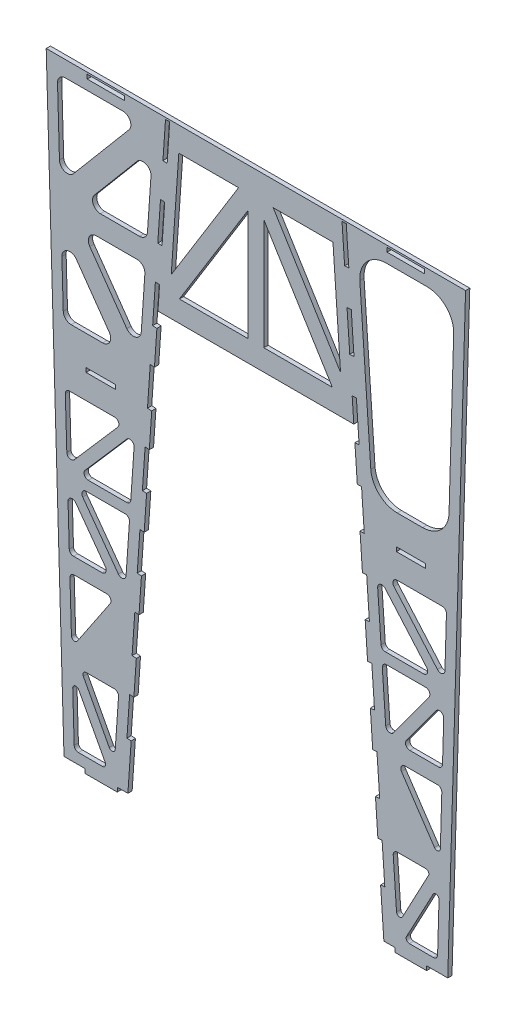
from build123d import *

# Parameters (mm, degrees)
BOSS_EXTRUDE1_DEPTH     = 10.16
CUT_EXTRUDE5_DEPTH      = 12.7
SKETCH4_W               = 90
SKETCH4_H               = 10.16
SKETCH4_W_2             = 70
CUT_EXTRUDE6_DEPTH      = 1549.932552155
CUT_EXTRUDE7_DEPTH      = 1549.932552155
FILLET3_R               = 10.16
FILLET4_R               = 7.62
FILLET5_R               = 19.05
FILLET3_OF_MIRROR2_R    = 10.16
FILLET4_OF_MIRROR2_R    = 7.62
FILLET5_OF_MIRROR2_R    = 19.05
CUT_EXTRUDE8_DEPTH      = 1549.932552155
CUT_EXTRUDE8_DEPTH_BACK = 1549.932552155
FILLET6_R               = 63.5
BOSS_EXTRUDE2_START     = -10.16
BOSS_EXTRUDE2_DEPTH     = 10.16


with BuildPart() as part:
    # Sketch1 → Boss-Extrude1 (new body)
    with BuildSketch(Plane.XY):
        Polygon((-502.379730266, 1465.163278322), (-459.721789204, 17.476365817), (-408.921789204, 17.476365817), (-408.921789204, 7.316365817), (-332.100796745, 7.316365817), (-332.100796745, 17.476365817), (-306.627827519, 17.476365817), (-234.627172097, 1054.1), (234.627172097, 1054.1), (306.627827519, 17.476365817), (332.721789205, 17.476365817), (332.721789205, 7.316365817), (408.921789205, 7.316365817), (408.921789205, 17.476365817), (459.721789204, 17.476365817), (502.379730266, 1465.163278322), align=None)
        Polygon((183.241683183, 1104.9), (19.05, 1104.9), (19.05, 1370.513387633), align=None, mode=Mode.SUBTRACT)
        Polygon((-184.672471746, 1406.743278322), (-41.445884435, 1406.743278322), (-202.802614973, 1145.716002246), align=None, mode=Mode.SUBTRACT)
        Polygon((-19.05, 1370.513387633), (-19.05, 1104.9), (-183.241683183, 1104.9), align=None, mode=Mode.SUBTRACT)
        Polygon((184.672471746, 1406.743278322), (202.802614973, 1145.716002246), (41.445884435, 1406.743278322), align=None, mode=Mode.SUBTRACT)
    extrude(amount=BOSS_EXTRUDE1_DEPTH)

    # Sketch2 → Cut-Extrude5 (cut)
    with BuildSketch(Plane.XY):
        Polygon((-222.69422447, 1372.274878096), (-212.576544386, 1371.572135487), (-206.36877838, 1460.947946306), (-216.535268781, 1460.947946306), align=None)
        Polygon((-224.894455765, 1194.225999066), (-235.012135849, 1194.928741675), (-228.490407278, 1288.824803216), (-218.372727194, 1288.122060607), align=None)
        Polygon((224.894455765, 1194.225999066), (235.012135849, 1194.928741675), (228.490407278, 1288.824803216), (218.372727194, 1288.122060607), align=None)
        Polygon((212.576544386, 1371.572135487), (222.694224471, 1372.274878096), (216.535268781, 1460.947946306), (206.36877838, 1460.947946306), align=None)
        Polygon((-240.810161517, 1111.452134365), (-247.330047228, 1017.582605255), (-237.212367144, 1016.879862645), (-230.692481433, 1110.749391756), align=None)
        Polygon((237.212367144, 1016.879862645), (247.330047228, 1017.582605255), (240.810161517, 1111.452134365), (230.692481433, 1110.749391756), align=None)
        Polygon((-298.801924037, 130.149180543), (-292.291252627, 223.886047498), (-302.408932711, 224.588790108), (-308.919604121, 130.851923152), align=None)
        Polygon((-243.012235672, 933.376722904), (-253.129915756, 934.079465513), (-259.647958606, 840.236468834), (-249.530278522, 839.533726225), align=None)
        Polygon((243.012235672, 933.376722904), (253.129915756, 934.079465513), (259.647958606, 840.236468834), (249.530278522, 839.533726225), align=None)
        Polygon((-274.16610128, 484.841453384), (-284.283781364, 485.544195993), (-277.769424233, 579.334127811), (-267.651744149, 578.631385201), align=None)
        Polygon((-261.848189901, 662.187589804), (-271.965869985, 662.890332413), (-265.449669994, 756.706796662), (-255.33198991, 756.004054053), align=None)
        Polygon((261.848189901, 662.187589804), (271.965869985, 662.890332413), (265.449669994, 756.706796662), (255.33198991, 756.004054053), align=None)
        Polygon((274.16610128, 484.841453384), (284.283781364, 485.544195993), (277.769424233, 579.334127811), (267.651744149, 578.631385201), align=None)
        Polygon((-286.484012658, 307.495316963), (-296.601692742, 308.198059572), (-290.089178472, 401.961458959), (-279.971498388, 401.25871635), align=None)
        Polygon((286.484012658, 307.495316963), (296.601692742, 308.198059572), (290.089178472, 401.961458959), (279.971498388, 401.25871635), align=None)
        Polygon((298.801924037, 130.149180543), (308.919604121, 130.851923152), (302.408932711, 224.588790108), (292.291252627, 223.886047498), align=None)
    extrude(amount=CUT_EXTRUDE5_DEPTH, mode=Mode.SUBTRACT)

    # Sketch4 → Cut-Extrude6 (cut, symmetric)
    with BuildSketch(Plane.XY.offset(10.16)):
        with Locations((359.197976087, 1455.867946306)):
            Rectangle(SKETCH4_W, SKETCH4_H)
        with Locations((371.773101272, 845.707946306)):
            Rectangle(SKETCH4_W_2, SKETCH4_H)
    cut_extrude6 = extrude(amount=CUT_EXTRUDE6_DEPTH, both=True, mode=Mode.SUBTRACT)

    # Mirror1: Cut-Extrude6 across plane
    add(cut_extrude6.mirror(Plane(origin=(0, 0, 0), x_dir=(0, 0, 1), z_dir=(1, 0, 0))), mode=Mode.SUBTRACT)

    # Sketch5 → Cut-Extrude7 (cut, symmetric)
    with BuildSketch(Plane.XY.offset(10.16)):
        Polygon((277.57407568, 1427.063278322), (469.151151359, 1199.858135079), (475.846040652, 1427.063278322), align=None)
        Polygon((247.332350967, 1384.123107242), (261.011042505, 1187.185612314), (413.388052133, 1187.185612314), align=None)
        Polygon((264.539459124, 1136.385612314), (278.411796263, 936.660125596), (419.073629592, 1136.385612314), align=None)
        Polygon((330.156313317, 921.907946306), (460.960994587, 921.907946306), (466.672719778, 1115.747348794), align=None)
        Polygon((316.123814072, 782.207946306), (452.23061276, 625.624084567), (456.844555932, 782.207946306), align=None)
        Polygon((289.718857385, 773.86792531), (300.433845179, 619.600037294), (423.812550982, 619.600037294), align=None)
        Polygon((302.198053489, 594.200037294), (313.00865126, 438.555614882), (426.677669108, 594.200037294), align=None)
        Polygon((348.650598884, 444.292128282), (446.887435422, 444.292128282), (451.017692353, 584.461080548), align=None)
        Polygon((338.197722634, 406.192128282), (441.242235204, 252.710390617), (445.764770334, 406.192128282), align=None)
        Polygon((316.139543948, 393.478923068), (326.550783398, 243.58421927), (416.77579504, 243.58421927), align=None)
        Polygon((328.314991708, 218.18421927), (338.831080002, 66.779965479), (419.448635625, 218.18421927), align=None)
        Polygon((354.87950725, 42.876310257), (435.059206432, 42.876310257), (439.756224914, 202.279507274), align=None)
    cut_extrude7 = extrude(amount=CUT_EXTRUDE7_DEPTH, both=True, mode=Mode.SUBTRACT)

    # Fillet3
    fillet3_edges = [part.edges().sort_by_distance(p)[0] for p in [
        (423.812550982, 619.600037294, 5.08),
        (300.433845179, 619.600037294, 5.08),
        (289.718857385, 773.86792531, 5.08),
        (426.677669108, 594.200037294, 5.08),
        (313.00865126, 438.555614882, 5.08),
        (302.198053489, 594.200037294, 5.08),
        (348.650598884, 444.292128282, 5.08),
        (451.017692353, 584.461080548, 5.08),
        (446.887435422, 444.292128282, 5.08),
        (338.197722634, 406.192128282, 5.08),
        (445.764770334, 406.192128282, 5.08),
        (316.123814072, 782.207946306, 5.08),
        (456.844555932, 782.207946306, 5.08),
        (452.23061276, 625.624084567, 5.08),
        (435.059206432, 42.876310257, 5.08),
        (328.314991708, 218.18421927, 5.08),
        (416.77579504, 243.58421927, 5.08),
        (326.550783398, 243.58421927, 5.08),
    ]]
    fillet(fillet3_edges, radius=FILLET3_R)

    # Fillet4
    fillet4_edges = [part.edges().sort_by_distance(p)[0] for p in [
        (441.242235204, 252.710390617, 5.08),
        (354.87950725, 42.876310257, 5.08),
        (439.756224914, 202.279507274, 5.08),
        (419.448635625, 218.18421927, 5.08),
        (338.831080002, 66.779965479, 5.08),
        (316.139543948, 393.478923068, 5.08),
    ]]
    fillet(fillet4_edges, radius=FILLET4_R)

    # Fillet5
    fillet5_edges = [part.edges().sort_by_distance(p)[0] for p in [
        (413.388052133, 1187.185612314, 5.08),
        (261.011042505, 1187.185612314, 5.08),
        (247.332350967, 1384.123107242, 5.08),
        (419.073629592, 1136.385612314, 5.08),
        (278.411796263, 936.660125596, 5.08),
        (264.539459124, 1136.385612314, 5.08),
        (330.156313317, 921.907946306, 5.08),
        (466.672719778, 1115.747348794, 5.08),
        (460.960994587, 921.907946306, 5.08),
        (277.57407568, 1427.063278322, 5.08),
        (475.846040652, 1427.063278322, 5.08),
        (469.151151359, 1199.858135079, 5.08),
    ]]
    fillet(fillet5_edges, radius=FILLET5_R)

    # Mirror2: Cut-Extrude7 across plane
    add(cut_extrude7.mirror(Plane(origin=(0, 0, 0), x_dir=(0, 0, 1), z_dir=(1, 0, 0))), mode=Mode.SUBTRACT)

    # Fillet3 of Mirror2
    fillet3_of_mirror2_edges = [part.edges().sort_by_distance(p)[0] for p in [
        (-423.812550982, 619.600037294, 5.08),
        (-300.433845179, 619.600037294, 5.08),
        (-289.718857385, 773.86792531, 5.08),
        (-426.677669108, 594.200037294, 5.08),
        (-313.00865126, 438.555614882, 5.08),
        (-302.198053489, 594.200037294, 5.08),
        (-348.650598884, 444.292128282, 5.08),
        (-451.017692353, 584.461080548, 5.08),
        (-446.887435422, 444.292128282, 5.08),
        (-338.197722634, 406.192128282, 5.08),
        (-445.764770334, 406.192128282, 5.08),
        (-316.123814072, 782.207946306, 5.08),
        (-456.844555932, 782.207946306, 5.08),
        (-452.23061276, 625.624084567, 5.08),
        (-435.059206432, 42.876310257, 5.08),
        (-328.314991708, 218.18421927, 5.08),
        (-416.77579504, 243.58421927, 5.08),
        (-326.550783398, 243.58421927, 5.08),
    ]]
    fillet(fillet3_of_mirror2_edges, radius=FILLET3_OF_MIRROR2_R)

    # Fillet4 of Mirror2
    fillet4_of_mirror2_edges = [part.edges().sort_by_distance(p)[0] for p in [
        (-441.242235204, 252.710390617, 5.08),
        (-354.87950725, 42.876310257, 5.08),
        (-439.756224914, 202.279507274, 5.08),
        (-419.448635625, 218.18421927, 5.08),
        (-338.831080002, 66.779965479, 5.08),
        (-316.139543948, 393.478923068, 5.08),
    ]]
    fillet(fillet4_of_mirror2_edges, radius=FILLET4_OF_MIRROR2_R)

    # Fillet5 of Mirror2
    fillet5_of_mirror2_edges = [part.edges().sort_by_distance(p)[0] for p in [
        (-413.388052133, 1187.185612314, 5.08),
        (-261.011042505, 1187.185612314, 5.08),
        (-247.332350967, 1384.123107242, 5.08),
        (-419.073629592, 1136.385612314, 5.08),
        (-278.411796263, 936.660125596, 5.08),
        (-264.539459124, 1136.385612314, 5.08),
        (-330.156313317, 921.907946306, 5.08),
        (-466.672719778, 1115.747348794, 5.08),
        (-460.960994587, 921.907946306, 5.08),
        (-277.57407568, 1427.063278322, 5.08),
        (-475.846040652, 1427.063278322, 5.08),
        (-469.151151359, 1199.858135079, 5.08),
    ]]
    fillet(fillet5_of_mirror2_edges, radius=FILLET5_OF_MIRROR2_R)

    # Sketch6 → Cut-Extrude8 (cut, two sides: drawn at the far end of the back side and taken through both)
    with BuildSketch(Plane.XY.offset(10.16).offset(-CUT_EXTRUDE8_DEPTH_BACK)):
        Polygon((244.349854643, 1427.063278322), (279.436438676, 921.907946306), (460.960994587, 921.907946306), (475.846040652, 1427.063278322), align=None)
    extrude(amount=CUT_EXTRUDE8_DEPTH + CUT_EXTRUDE8_DEPTH_BACK, mode=Mode.SUBTRACT)

    # Fillet6
    fillet6_edges = [part.edges().sort_by_distance(p)[0] for p in [
        (279.436438676, 921.907946306, 5.08),
        (244.349854643, 1427.063278322, 5.08),
        (475.846040652, 1427.063278322, 5.08),
        (460.960994587, 921.907946306, 5.08),
    ]]
    fillet(fillet6_edges, radius=FILLET6_R)

    # Sketch7 → Boss-Extrude2 (add)
    with BuildSketch(Plane.XY.offset(10.16).offset(BOSS_EXTRUDE2_START)):
        with BuildLine():
            Line((-336.029577918, 243.58421927), (-397.717151688, 243.58421927))
            ThreePointArc((-397.717151688, 243.58421927), (-406.682757845, 248.964731198), (-406.152389421, 259.407466076))
            Line((-406.152389421, 259.407466076), (-332.044810953, 369.788500773))
            ThreePointArc((-332.044810953, 369.788500773), (-323.246997886, 372.74916232), (-318.116696913, 365.01307523))
            Line((-318.116696913, 365.01307523), (-325.893996931, 253.040232018))
            ThreePointArc((-325.893996931, 253.040232018), (-329.098737799, 246.315285615), (-336.029577918, 243.58421927))
        make_face()
    boss_extrude2 = extrude(amount=BOSS_EXTRUDE2_DEPTH)

    # Mirror3: Boss-Extrude2 across plane
    add(boss_extrude2.mirror(Plane(origin=(0, 0, 0), x_dir=(0, 0, 1), z_dir=(1, 0, 0))))


solid = part.part
